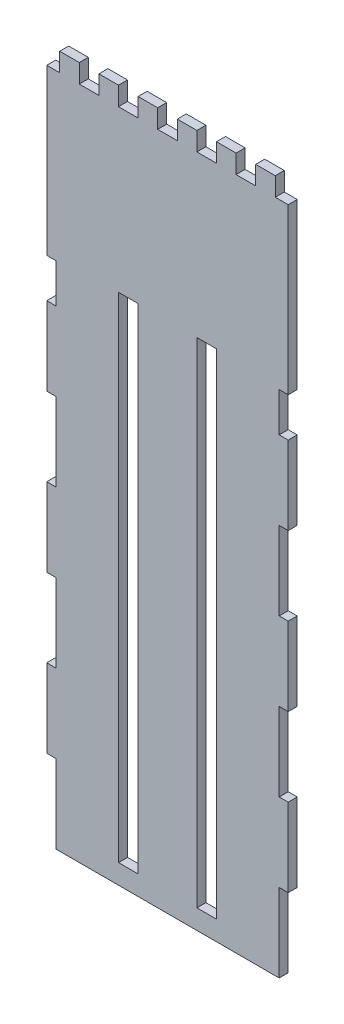
from build123d import *

# Parameters (mm, degrees)
SKETCH1_W           = 78.232
SKETCH1_H           = 218.44
BOSS_EXTRUDE1_DEPTH = 1.4605
SKETCH2_W           = 2.921
SKETCH2_H           = 25.4
SKETCH2_H_2         = 12.7
CUT_EXTRUDE1_DEPTH  = 2.921
SKETCH3_W           = 6.35
SKETCH3_H           = 2.921
BOSS_EXTRUDE2_DEPTH = 6.0452
SKETCH5_W           = 6.35
SKETCH5_H           = 160.02
CUT_EXTRUDE2_DEPTH  = 122.756560513


with BuildPart() as part:
    # Sketch1 → Boss-Extrude1 (new, symmetric)
    with BuildSketch(Plane.XY):
        Rectangle(SKETCH1_W, SKETCH1_H)
    extrude(amount=BOSS_EXTRUDE1_DEPTH, both=True)

    # Sketch2 → Cut-Extrude1 (cut)
    with BuildSketch(Plane.XY.offset(1.4605)):
        with Locations((-37.6555, -96.52)):
            Rectangle(SKETCH2_W, SKETCH2_H)
        with Locations((-37.6555, -45.72)):
            Rectangle(SKETCH2_W, SKETCH2_H)
        with Locations((-37.6555, 5.08)):
            Rectangle(SKETCH2_W, SKETCH2_H)
        with Locations((-37.6555, 49.53)):
            Rectangle(SKETCH2_W, SKETCH2_H_2)
        with Locations((37.6555, 49.53)):
            Rectangle(SKETCH2_W, SKETCH2_H_2)
        with Locations((37.6555, 5.08)):
            Rectangle(SKETCH2_W, SKETCH2_H)
        with Locations((37.6555, -96.52)):
            Rectangle(SKETCH2_W, SKETCH2_H)
        with Locations((37.6555, -45.72)):
            Rectangle(SKETCH2_W, SKETCH2_H)
    extrude(amount=-CUT_EXTRUDE1_DEPTH, mode=Mode.SUBTRACT)

    # Sketch3 → Boss-Extrude2 (add)
    with BuildSketch(Plane(origin=(0, 109.22, 0), x_dir=(1, 0, 0), z_dir=(0, 1, 0))):
        with Locations((31.75, 0)):
            Rectangle(SKETCH3_W, SKETCH3_H)
        with Locations((19.05, 0)):
            Rectangle(SKETCH3_W, SKETCH3_H)
        with Locations((6.35, 0)):
            Rectangle(SKETCH3_W, SKETCH3_H)
        with Locations((-6.35, 0)):
            Rectangle(SKETCH3_W, SKETCH3_H)
        with Locations((-19.05, 0)):
            Rectangle(SKETCH3_W, SKETCH3_H)
        with Locations((-31.75, 0)):
            Rectangle(SKETCH3_W, SKETCH3_H)
    extrude(amount=BOSS_EXTRUDE2_DEPTH)

    # Sketch5 → Cut-Extrude2 (cut, through all)
    with BuildSketch(Plane.XY.offset(1.4605)):
        with Locations((-12.7, -22.86)):
            Rectangle(SKETCH5_W, SKETCH5_H)
        with Locations((12.7, -22.86)):
            Rectangle(SKETCH5_W, SKETCH5_H)
    extrude(amount=-CUT_EXTRUDE2_DEPTH, mode=Mode.SUBTRACT)


solid = part.part
